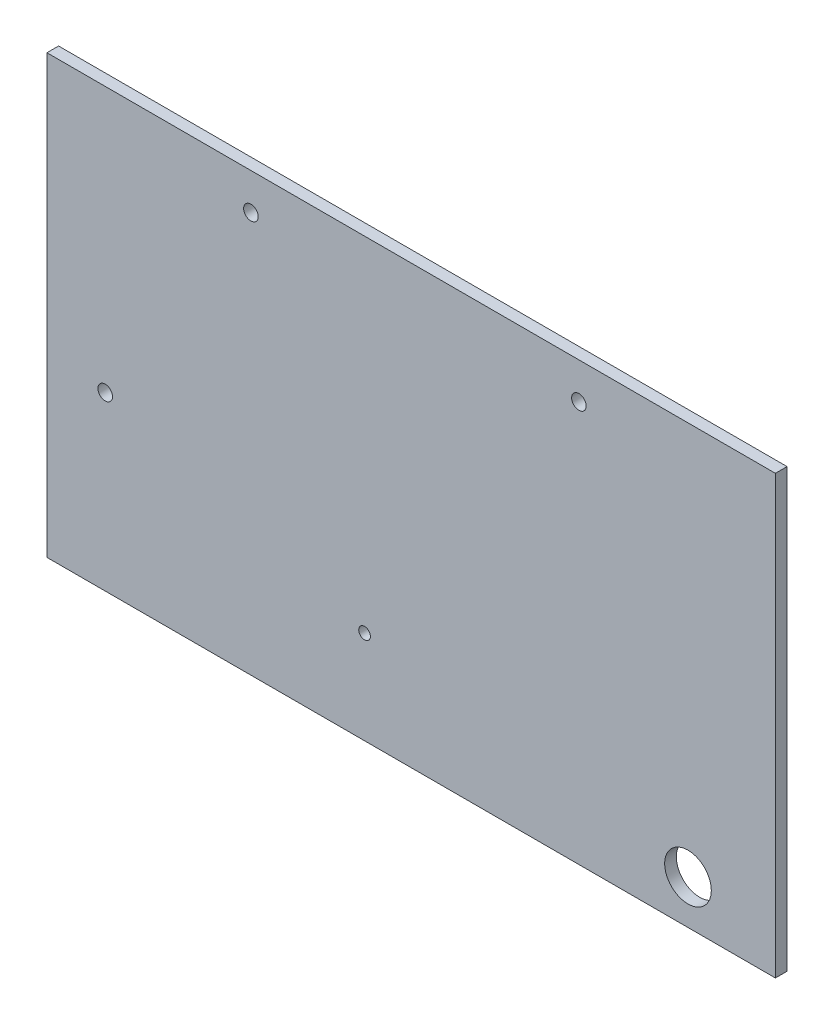
from build123d import *

# Parameters (mm, degrees)
SKETCH1_W           = 250
SKETCH1_H           = 150
BOSS_EXTRUDE1_DEPTH = 4
SKETCH2_R           = 8
CUT_EXTRUDE1_DEPTH  = 4
SKETCH3_R           = 2.5
SKETCH3_R_2         = 2
CUT_EXTRUDE2_DEPTH  = 4


with BuildPart() as part:
    # Sketch1 → Boss-Extrude1 (new body)
    with BuildSketch(Plane.XY):
        with Locations((12.175324675, -10.633116883)):
            Rectangle(SKETCH1_W, SKETCH1_H)
    extrude(amount=BOSS_EXTRUDE1_DEPTH)

    # Sketch2 → Cut-Extrude1 (cut)
    with BuildSketch(Plane.XY.offset(4)):
        with Locations((107.175324675, -70.633116883)):
            Circle(SKETCH2_R)
    extrude(amount=-CUT_EXTRUDE1_DEPTH, mode=Mode.SUBTRACT)

    # Sketch3 → Cut-Extrude2 (cut)
    with BuildSketch(Plane(origin=(0, 0, 0), x_dir=(-1, 0, 0), z_dir=(0, 0, -1))):
        with Locations((42.824675325, 51.866883117)):
            Circle(SKETCH3_R)
        with Locations((92.824675325, -26.633116883)):
            Circle(SKETCH3_R)
        with Locations((-69.739145404, 51.866883117)):
            Circle(SKETCH3_R)
        with Locations((3.824675325, -53.633116883)):
            Circle(SKETCH3_R_2)
    extrude(amount=-CUT_EXTRUDE2_DEPTH, mode=Mode.SUBTRACT)


solid = part.part
